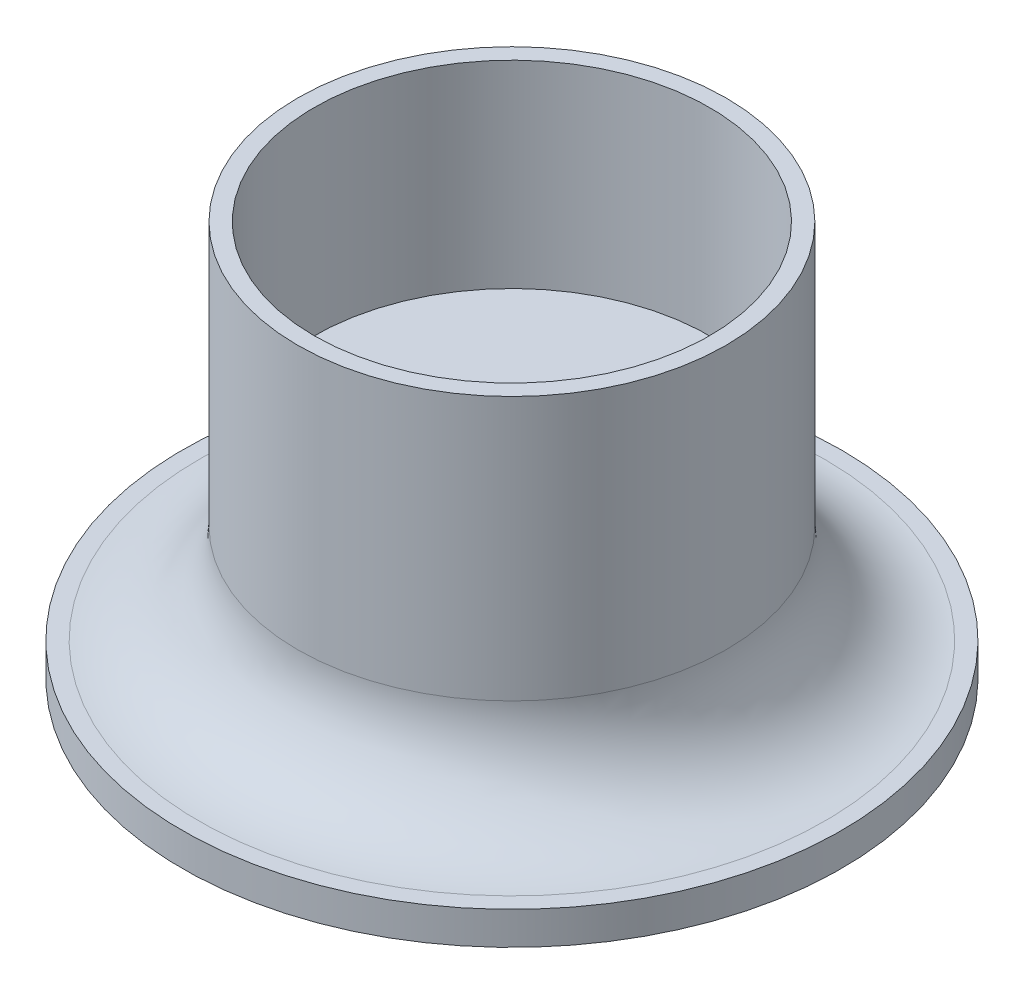
from build123d import *

# Parameters (mm, degrees)
SKETCH_1_R      = 65
EXTRUDE_1_DEPTH = 50
SKETCH_2_R      = 65
SKETCH_2_R_2    = 60
EXTRUDE_2_DEPTH = 60
SKETCH_3_R      = 100
EXTRUDE_3_DEPTH = 10
FILLET_1_R      = 30


with BuildPart() as part:
    # 草图1 → 凸台-拉伸1 (new body)
    with BuildSketch(Plane(origin=(0, 0, 0), x_dir=(1, 0, 0), z_dir=(0, 1, 0))):
        with Locations(Location((0, 0, 0), (0, 0, 270))):
            Circle(SKETCH_1_R)
    extrude(amount=EXTRUDE_1_DEPTH)

    # 草图2 → 凸台-拉伸2 (add)
    with BuildSketch(Plane(origin=(0, 50, 0), x_dir=(1, 0, 0), z_dir=(0, 1, 0))):
        with Locations(Location((0, 0, 0), (0, 0, 270))):
            Circle(SKETCH_2_R)
        with Locations(Location((0, 0, 0), (0, 0, 270))):
            Circle(SKETCH_2_R_2, mode=Mode.SUBTRACT)
    extrude(amount=EXTRUDE_2_DEPTH)

    # 草图3 → 凸台-拉伸3 (add)
    with BuildSketch(Plane.XZ):
        with Locations(Location((0, 0, 0), (0, 0, 270))):
            Circle(SKETCH_3_R)
    extrude(amount=EXTRUDE_3_DEPTH)

    # 圆角1
    fillet_1_edges = [part.edges().sort_by_distance(p)[0] for p in [
        (0, 0, -65),
    ]]
    fillet(fillet_1_edges, radius=FILLET_1_R)


solid = part.part
